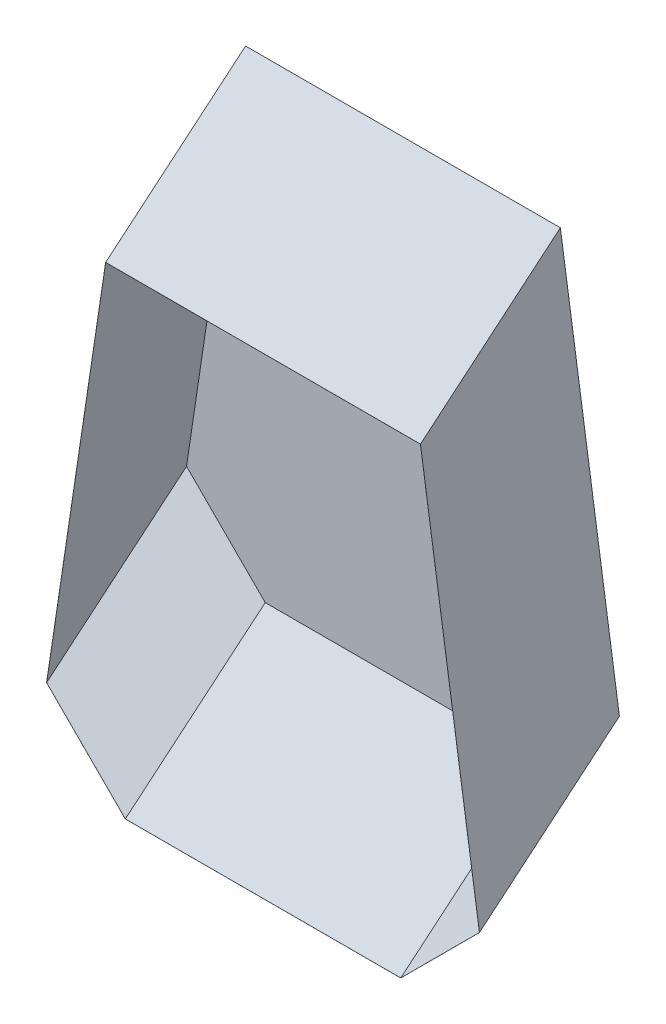
from build123d import *

# Parameters (mm, degrees)
SHELL2_T = -0.0254


with BuildPart() as part:
    # Sweep2: sweep along a path in Sketch2
    with BuildLine(Plane(origin=(0, 0, 0), x_dir=(0, 0, -1), z_dir=(1, 0, 0))) as sweep2_path:
        Line((-325, 0), (-502.8, -149.191914423))
    # Sketch3 → Sweep2 (sweep)
    with BuildSketch(Plane.XY.offset(325)):
        Polygon((200, 0), (-200, 0), (-275, -500), (-175, -600), (175, -600), (275, -500), align=None)
    sweep(path=sweep2_path.line)

    # Shell2
    shell2_openings = [part.faces().sort_by_distance(p)[0] for p in [
        (0, -457.451501444, 502.8),
    ]]
    offset(amount=SHELL2_T, openings=shell2_openings, kind=Kind.INTERSECTION)


solid = part.part
